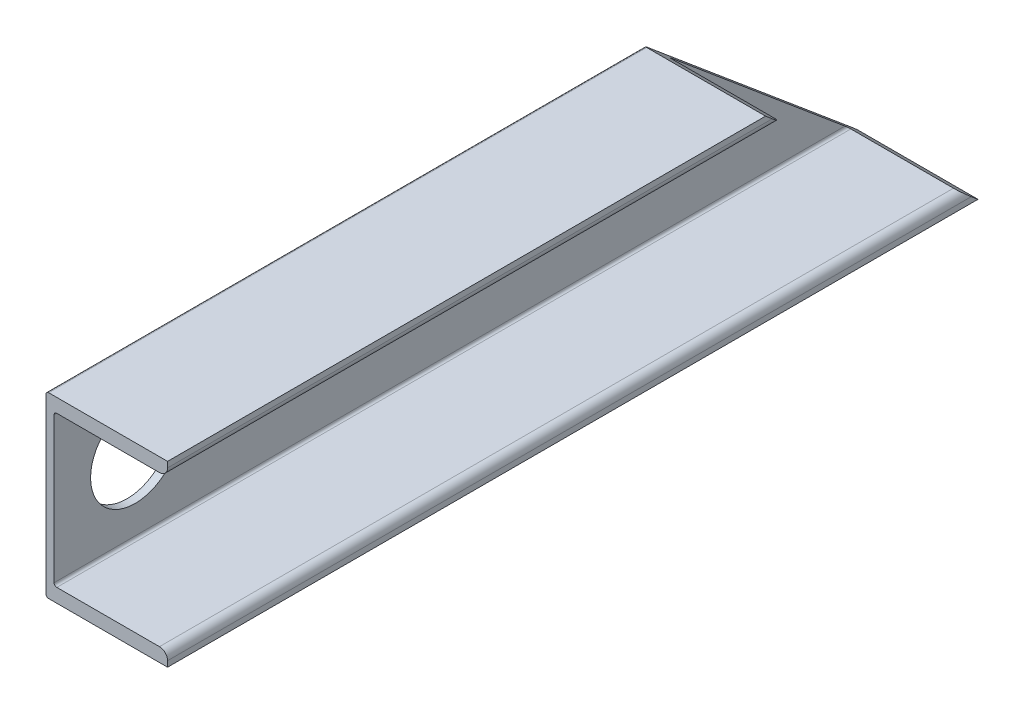
from build123d import *

# Parameters (mm, degrees)
BOSS_EXTRUDE1_DEPTH = 300
CUT_EXTRUDE1_REACH  = 307.146
FILLET1_R           = 3
FILLET2_R           = 1
SKETCH4_R           = 16.5
CUT_EXTRUDE2_DEPTH  = 10


with BuildPart() as part:
    # Sketch1 → Boss-Extrude1 (new body)
    with BuildSketch(Plane.XY):
        Polygon((0, 33), (0, -33), (45, -33), (45, -27.9), (3, -27.9), (3, 27.9), (45, 27.9), (45, 33), align=None)
    extrude(amount=BOSS_EXTRUDE1_DEPTH)

    # Sketch3 → Cut-Extrude1 (cut, up to next)
    with BuildSketch(Plane.ZY, mode=Mode.PRIVATE) as cut_extrude1_sk1:
        Polygon((0, -33), (0, 33), (78.655737111, 33), align=None)
    cut_extrude1_tool1 = extrude(cut_extrude1_sk1.sketch, amount=-CUT_EXTRUDE1_REACH, mode=Mode.PRIVATE) & part.part
    add(cut_extrude1_tool1.solids().sort_by_distance((0, 11, 26.218579))[0], mode=Mode.SUBTRACT)

    # Fillet1
    fillet1_edges = [part.edges().sort_by_distance(p)[0] for p in [
        (45, -27.9, 153.038971661),
        (45, 27.9, 186.288896894),
    ]]
    fillet(fillet1_edges, radius=FILLET1_R)

    # Fillet2
    fillet2_edges = [part.edges().sort_by_distance(p)[0] for p in [
        (3, -27.9, 153.038971661),
        (0, -33, 150),
        (0, 33, 189.327868556),
        (3, 27.9, 186.288896894),
    ]]
    fillet(fillet2_edges, radius=FILLET2_R)

    # Sketch4 → Cut-Extrude2 (cut)
    with BuildSketch(Plane.ZY):
        with Locations(Location((270, 0, 0), (0, 0, 270))):
            Circle(SKETCH4_R)
    extrude(amount=-CUT_EXTRUDE2_DEPTH, mode=Mode.SUBTRACT)


solid = part.part
